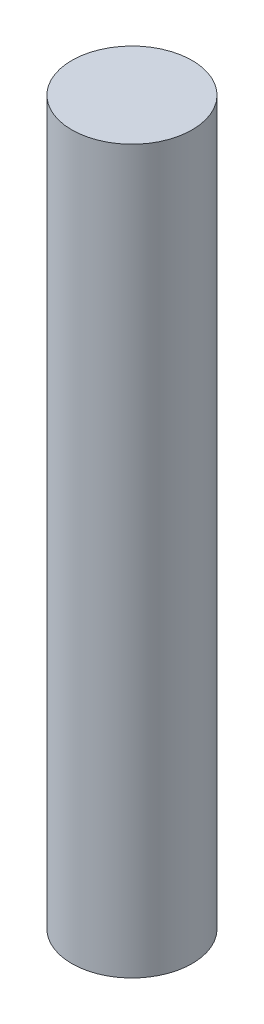
from build123d import *

# Parameters (mm, degrees)
SKETCH1_R           = 4
BOSS_EXTRUDE1_DEPTH = 48


with BuildPart() as part:
    # Sketch1 → Boss-Extrude1 (new body)
    with BuildSketch(Plane(origin=(0, 0, 0), x_dir=(1, 0, 0), z_dir=(0, 1, 0))):
        with Locations(Location((0, 0, 0), (0, 0, 270))):
            Circle(SKETCH1_R)
    extrude(amount=BOSS_EXTRUDE1_DEPTH)


solid = part.part
